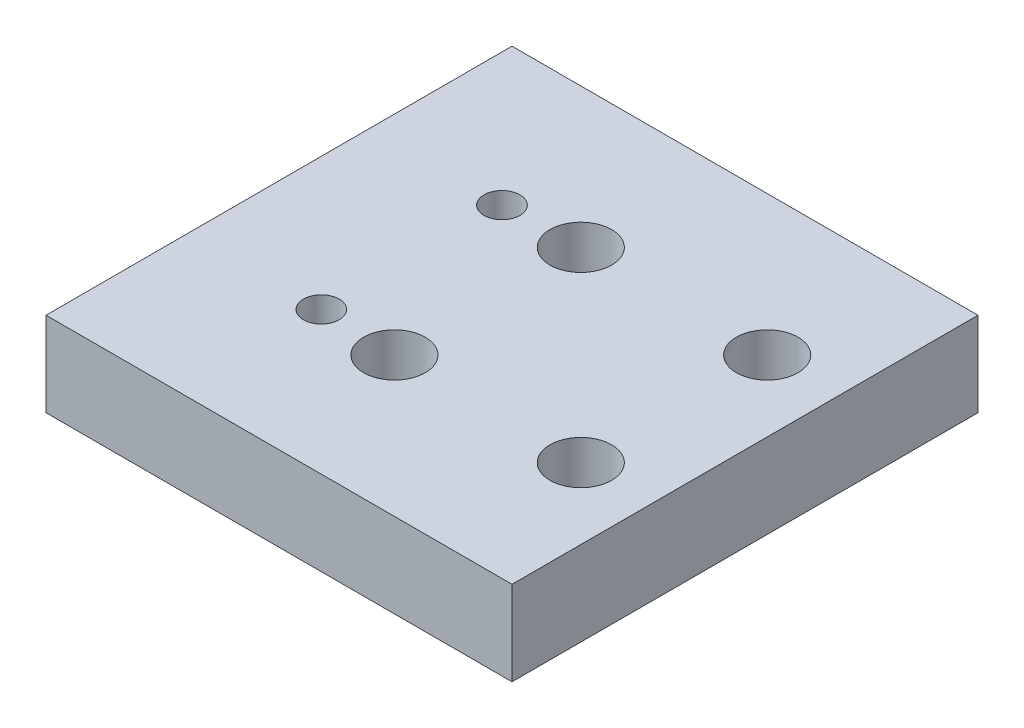
from build123d import *

# Parameters (mm, degrees)
SKETCH1_W                       = 65
SKETCH1_H                       = 65
EXTRUDE1_DEPTH                  = 11.7824246
M6X1_0_TAPPED_HOLE1_D           = 5
CBORE_FOR_M4_SBHCS1_D           = 4.8
CBORE_FOR_M4_SBHCS1_CBORE_D     = 8.6
CBORE_FOR_M4_SBHCS1_CBORE_DEPTH = 8.2


with BuildPart() as part:
    # Sketch1 → Extrude1 (new body)
    with BuildSketch(Plane(origin=(0, 0, 0), x_dir=(1, 0, 0), z_dir=(0, 1, 0))):
        Rectangle(SKETCH1_W, SKETCH1_H)
    extrude(amount=EXTRUDE1_DEPTH)

    # M6x1.0 Tapped Hole1 (through all)
    with Locations(Plane(origin=(0, 11.7824246, 0), x_dir=(-1, 0, 0), z_dir=(0, 1, 0))):
        with Locations((14, -12.6), (14, 12.6)):
            Hole(M6X1_0_TAPPED_HOLE1_D / 2)

    # CBORE for M4 SBHCS1 (through all)
    with Locations(Plane(origin=(0, 11.7824246, 0), x_dir=(-1, 0, 0), z_dir=(0, 1, 0))):
        with Locations((3.402638838, 13), (-22.597361162, 13), (-22.597361162, -13), (3.402638838, -13)):
            CounterBoreHole(CBORE_FOR_M4_SBHCS1_D / 2, CBORE_FOR_M4_SBHCS1_CBORE_D / 2, CBORE_FOR_M4_SBHCS1_CBORE_DEPTH)


solid = part.part
